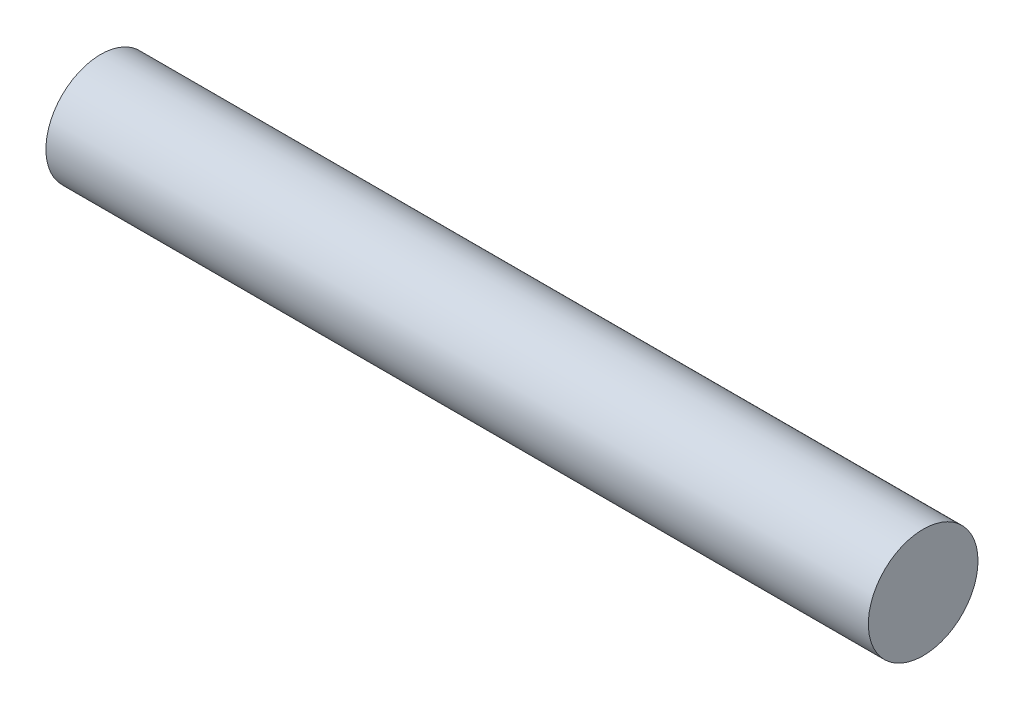
from build123d import *

# Parameters (mm, degrees)
SKETCH1_R           = 2
BOSS_EXTRUDE1_DEPTH = 30


with BuildPart() as part:
    # Sketch1 → Boss-Extrude1 (new body)
    with BuildSketch(Plane(origin=(0, 0, 0), x_dir=(0, 0, -1), z_dir=(1, 0, 0))):
        Circle(SKETCH1_R)
    extrude(amount=BOSS_EXTRUDE1_DEPTH)


solid = part.part
